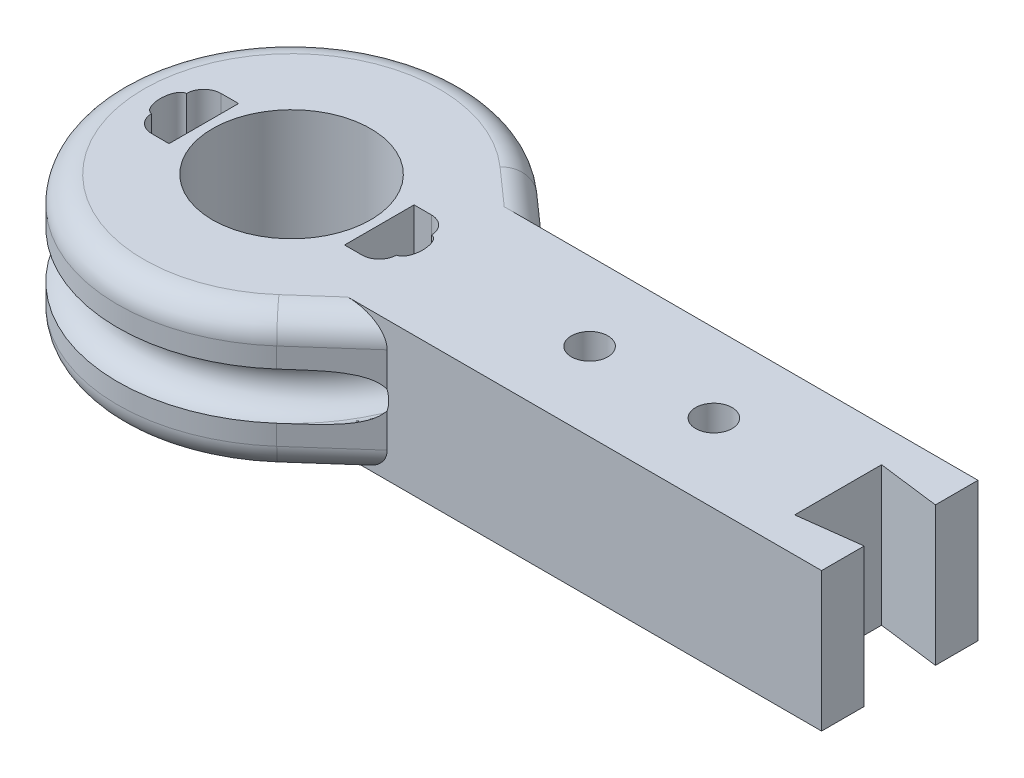
from build123d import *

# Parameters (mm, degrees)
SKETCH1_R           = 4.55
BOSS_EXTRUDE2_DEPTH = 8
FILLET2_R           = 1.5
SKETCH5_R           = 1.0499999999999987
CUT_EXTRUDE1_DEPTH  = 10


with BuildPart() as part:
    # Sketch1 → Boss-Extrude2 (new body)
    with BuildSketch(Plane(origin=(0, 0, 0), x_dir=(1, 0, 0), z_dir=(0, 1, 0))):
        with BuildLine():
            Line((9.999999999999998, 4.499999999999999), (6.632016632016632, 7.484407484407484))
            ThreePointArc((6.632016632016632, 7.484407484407484), (-10, 5.67e-15), (6.6320166320166285, -7.484407484407485))
            Line((6.6320166320166285, -7.484407484407485), (10, -4.500000000000002))
            Line((10, -4.500000000000002), (35, -4.500000000000001))
            Line((35, -4.500000000000001), (35, -2.0499999999999954))
            Line((35, -2.0499999999999954), (31.450000000000006, -2.5000000000000004))
            Line((31.450000000000006, -2.5000000000000004), (31.450000000000006, 2.4999999999999987))
            Line((31.450000000000006, 2.4999999999999987), (35, 2.0499999999999954))
            Line((35, 2.0499999999999954), (35, 4.499999999999999))
            Line((35, 4.499999999999999), (9.999999999999998, 4.499999999999999))
        make_face()
        with Locations(Location((0, 0, 0), (0, 0, 270))):
            Circle(SKETCH1_R, mode=Mode.SUBTRACT)
        with BuildLine():
            Line((5.050000000000003, 2.0000000000000013), (6.050000000000003, 2.0000000000000013))
            ThreePointArc((6.050000000000003, 2.0000000000000013), (6.75710678118655, 1.7071067811865483), (7.0500000000000025, 1.000000000000001))
            add(Edge.make_bspline(
                [(7.0500000000000025, -0.9999999999999968), (7.5500000000000025, -0.9999999999999982), (7.5500000000000025, 1.34e-15), (7.550000000000002, 1.0000000000000009), (7.0500000000000025, 1.000000000000001)],
                knots=[0, 0, 0, 1.5707963267948966, 1.5707963267948966, 3.141592653589793, 3.141592653589793, 3.141592653589793], degree=2, weights=[1, 0.7071067811865476, 1, 0.7071067811865476, 1]))
            ThreePointArc((7.0500000000000025, -0.9999999999999968), (6.75710678118655, -1.707106781186544), (6.050000000000004, -1.9999999999999971))
            Line((6.050000000000004, -1.9999999999999971), (5.050000000000004, -1.9999999999999978))
            Line((5.050000000000004, -1.9999999999999978), (5.050000000000003, 2.0000000000000013))
        make_face(mode=Mode.SUBTRACT)
        with BuildLine():
            Line((-5.050000000000001, -2), (-6.050000000000001, -2))
            ThreePointArc((-6.050000000000001, -2), (-6.757106781186548, -1.7071067811865477), (-7.050000000000001, -1.0000000000000002))
            add(Edge.make_bspline(
                [(-7.050000000000001, 0.9999999999999993), (-7.550000000000002, 0.9999999999999994), (-7.550000000000001, -3.6e-16), (-7.550000000000001, -1), (-7.050000000000001, -1.0000000000000002)],
                knots=[3.141592653589793, 3.141592653589793, 3.141592653589793, 4.71238898038469, 4.71238898038469, 6.283185307179586, 6.283185307179586, 6.283185307179586], degree=2, weights=[1, 0.7071067811865476, 1, 0.7071067811865476, 1]))
            ThreePointArc((-7.050000000000001, 0.9999999999999993), (-6.757106781186549, 1.7071067811865468), (-6.050000000000002, 2))
            Line((-6.050000000000002, 2), (-5.050000000000002, 2))
            Line((-5.050000000000002, 2), (-5.050000000000001, -2))
        make_face(mode=Mode.SUBTRACT)
    extrude(amount=BOSS_EXTRUDE2_DEPTH)

    # Fillet2
    fillet2_edges = [part.edges().sort_by_distance(p)[0] for p in [
        (8.316008316008315, 8, -5.992203742203742),
        (8.316008316008315, 0, -5.992203742203742),
        (-10, 0, -1.33e-15),
        (8.316008316008315, 0, 5.992203742203744),
        (8.316008316008315, 8, 5.992203742203744),
        (-10, 8, -1.33e-15),
    ]]
    fillet(fillet2_edges, radius=FILLET2_R)

    # Sketch5 → Cut-Extrude1 (cut)
    with BuildSketch(Plane(origin=(0, 8, 0), x_dir=(1, 0, 0), z_dir=(0, 1, 0))):
        with Locations(Location((17.15, 0, 0), (0, 0, 270))):
            Circle(SKETCH5_R)
        with Locations(Location((24.300000000000004, 0, 0), (0, 0, 270))):
            Circle(SKETCH5_R)
    extrude(amount=-CUT_EXTRUDE1_DEPTH, mode=Mode.SUBTRACT)

    # Sketch4 → Cut-Revolve1 (revolve, cut)
    with BuildSketch(Plane(origin=(-6.666818896321271, 16.53530046448365, 0), x_dir=(0, 1, 0), z_dir=(0, 0, 1)), mode=Mode.PRIVATE) as cut_revolve1_sk:
        with BuildLine():
            ThreePointArc((-13.885300464483652, 3.3331811036787276), (-12.535300464483653, 1.983181103678728), (-11.185300464483651, 3.3331811036787284))
            add(Edge.make_bspline(
                [(-11.185300464483651, 3.3331811036787284), (-11.185300464483655, 4.383181103678727), (-12.535300464483653, 4.383181103678727), (-13.885300464483652, 4.383181103678727), (-13.885300464483652, 3.3331811036787276)],
                knots=[3.141592653589794, 3.141592653589794, 3.141592653589794, 4.71238898038469, 4.71238898038469, 6.283185307179586, 6.283185307179586, 6.283185307179586], degree=2, weights=[1, 0.7071067811865477, 1, 0.7071067811865477, 1]))
        make_face()
    revolve(cut_revolve1_sk.sketch.rotate(Axis((0, 0, 0), (0, 1, 0)), 228.455490636), axis=Axis((0, 0, 0), (0, 1, 0)), mode=Mode.SUBTRACT)


solid = part.part
